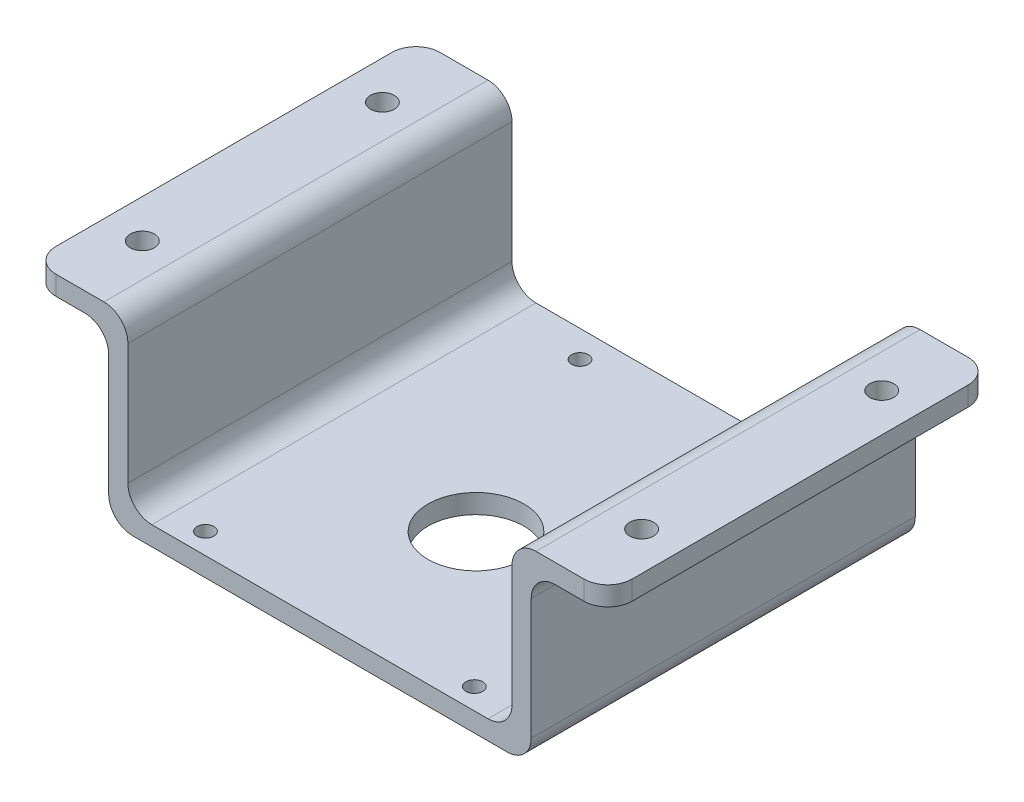
from build123d import *

# Parameters (mm, degrees)
SKETCH2_W           = 80
SKETCH2_H           = 80
BOSS_EXTRUDE1_DEPTH = 4
SKETCH3_R           = 10
CUT_EXTRUDE1_DEPTH  = 4
SKETCH4_R           = 1.75
CUT_EXTRUDE2_DEPTH  = 10
SKETCH7_W           = 80
SKETCH7_H           = 39.2
BOSS_EXTRUDE3_DEPTH = 4
SKETCH8_W           = 20
SKETCH8_H           = 80
BOSS_EXTRUDE4_DEPTH = 4
SKETCH9_R           = 2.5
CUT_EXTRUDE3_DEPTH  = 4
FILLET1_R           = 5


with BuildPart() as part:
    # Sketch2 → Boss-Extrude1 (new body)
    with BuildSketch(Plane(origin=(0, 0, 0), x_dir=(1, 0, 0), z_dir=(0, 1, 0))):
        Rectangle(SKETCH2_W, SKETCH2_H)
    extrude(amount=BOSS_EXTRUDE1_DEPTH)

    # Sketch3 → Cut-Extrude1 (cut)
    with BuildSketch(Plane(origin=(0, 4, 0), x_dir=(1, 0, 0), z_dir=(0, 1, 0))):
        with Locations(Location((0, -7.5, 0), (0, 0, 270))):
            Circle(SKETCH3_R)
    extrude(amount=-CUT_EXTRUDE1_DEPTH, mode=Mode.SUBTRACT)

    # Sketch4 → Cut-Extrude2 (cut)
    with BuildSketch(Plane(origin=(0, 4, 0), x_dir=(1, 0, 0), z_dir=(0, 1, 0))):
        with Locations(Location((-28.231866882, -35.612184397, 0), (0, 0, 270))):
            Circle(SKETCH4_R)
        with Locations(Location((27.768133118, -35.612184397, 0), (0, 0, 270))):
            Circle(SKETCH4_R)
        with Locations(Location((19.768133118, 34.387815603, 0), (0, 0, 270))):
            Circle(SKETCH4_R)
        with Locations(Location((-20.231866882, 34.387815603, 0), (0, 0, 270))):
            Circle(SKETCH4_R)
    extrude(amount=-CUT_EXTRUDE2_DEPTH, mode=Mode.SUBTRACT)

    # Sketch7 → Boss-Extrude3 (add)
    with BuildSketch(Plane.ZY.offset(40)):
        with Locations((0, 19.6)):
            Rectangle(SKETCH7_W, SKETCH7_H)
    boss_extrude3 = extrude(amount=BOSS_EXTRUDE3_DEPTH)

    # Mirror2: Boss-Extrude3 across plane
    add(boss_extrude3.mirror(Plane(origin=(0, 0, 0), x_dir=(0, 0, 1), z_dir=(1, 0, 0))))

    # Sketch8 → Boss-Extrude4 (add)
    with BuildSketch(Plane(origin=(0, 39.2, 0), x_dir=(1, 0, 0), z_dir=(0, 1, 0))):
        with Locations((-50, 0)):
            Rectangle(SKETCH8_W, SKETCH8_H)
    boss_extrude4 = extrude(amount=-BOSS_EXTRUDE4_DEPTH)

    # Mirror3: Boss-Extrude4 across plane
    add(boss_extrude4.mirror(Plane(origin=(0, 0, 0), x_dir=(0, 0, 1), z_dir=(1, 0, 0))))

    # Sketch9 → Cut-Extrude3 (cut)
    with BuildSketch(Plane(origin=(0, 39.2, 0), x_dir=(1, 0, 0), z_dir=(0, 1, 0))):
        with Locations(Location((-52, -25, 0), (0, 0, 270))):
            Circle(SKETCH9_R)
        with Locations(Location((-52, 25, 0), (0, 0, 90))):
            Circle(SKETCH9_R)
        with Locations(Location((52, 25, 0), (0, 0, 270))):
            Circle(SKETCH9_R)
        with Locations(Location((52, -25, 0), (0, 0, 90))):
            Circle(SKETCH9_R)
    extrude(amount=-CUT_EXTRUDE3_DEPTH, mode=Mode.SUBTRACT)

    # Fillet1
    fillet1_edges = [part.edges().sort_by_distance(p)[0] for p in [
        (40, 4, 0),
        (-40, 4, 0),
        (-40, 39.2, 0),
        (-44, 0, 0),
        (40, 39.2, 0),
        (44, 0, 0),
        (-44, 35.2, 0),
        (-60, 37.2, -40),
        (-60, 37.2, 40),
        (44, 35.2, 0),
        (60, 37.2, 40),
        (60, 37.2, -40),
    ]]
    fillet(fillet1_edges, radius=FILLET1_R)


solid = part.part
